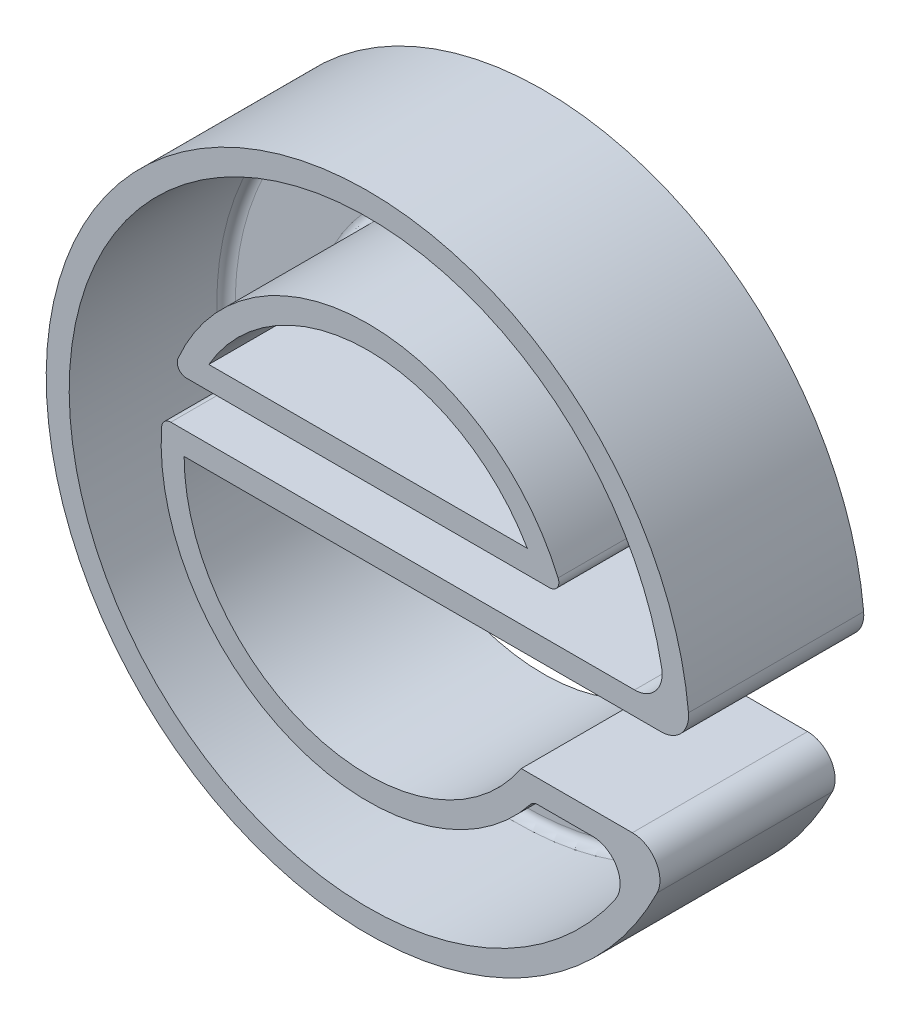
from build123d import *

# Parameters (mm, degrees)
BOSS_EXTRUDE6_DEPTH = 19.05
CUT_EXTRUDE2_DEPTH  = 17.05
FILLET2_R           = 3
FILLET1_R           = 1


with BuildPart() as part:
    # Sketch3 → Boss-Extrude6 (new body)
    with BuildSketch(Plane.XY):
        with BuildLine():
            Line((0, 0), (35, 0))
            ThreePointArc((35, 0), (-34.548087395, 5.606215958), (33.204019579, -11.067659364))
            Line((33.204019579, -11.067659364), (16.658538837, -11.067659364))
            ThreePointArc((16.658538837, -11.067659364), (-5.780537313, -19.146419727), (-20, 0))
            Line((-20, 0), (0, 0))
        make_face()
        with BuildLine():
            Line((-17.320508076, 10), (17.320508076, 10))
            ThreePointArc((17.320508076, 10), (0, 20), (-17.320508076, 10))
        make_face(mode=Mode.SUBTRACT)
    extrude(amount=BOSS_EXTRUDE6_DEPTH)

    # Sketch6 → Cut-Extrude2 (cut)
    with BuildSketch(Plane.XY.offset(19.05)):
        with BuildLine():
            Line((29.532501069, -13.567659364), (17.949056225, -13.567659364))
            ThreePointArc((17.949056225, -13.567659364), (-8.331147877, -20.900764939), (-22.360679775, 2.5))
            Line((-22.360679775, 2.5), (20, 2.5))
            Line((20, 2.5), (32.403703492, 2.5))
            ThreePointArc((32.403703492, 2.5), (-31.993214565, 5.717011614), (29.532501069, -13.567659364))
        make_face()
        with BuildLine():
            Line((21.213203436, 7.5), (-21.213203436, 7.5))
            ThreePointArc((-21.213203436, 7.5), (0, 22.5), (21.213203436, 7.5))
        make_face(mode=Mode.SUBTRACT)
    extrude(amount=-CUT_EXTRUDE2_DEPTH, mode=Mode.SUBTRACT)

    # Fillet2
    fillet2_edges = [part.edges().sort_by_distance(p)[0] for p in [
        (29.532501069, -13.567659364, 10.525),
        (32.403703492, 2.5, 10.525),
        (33.204019579, -11.067659364, 9.525),
        (35, 0, 9.525),
    ]]
    fillet(fillet2_edges, radius=FILLET2_R)

    # Fillet1
    fillet1_edges = [part.edges().sort_by_distance(p)[0] for p in [
        (3.311036859, 2.5, 2),
        (-8.331147877, -20.900764939, 2),
        (-22.360679775, 2.5, 10.525),
        (17.949056225, -13.567659364, 10.525),
        (0, 7.5, 2),
        (0, 22.5, 2),
        (21.213203436, 7.5, 10.525),
        (-21.213203436, 7.5, 10.525),
        (-31.823448952, 6.596824754, 2),
        (21.178653063, -13.567659364, 2),
        (27.059149761, -15.16312032, 2),
        (31.293377445, 3.586621588, 2),
    ]]
    fillet(fillet1_edges, radius=FILLET1_R)


solid = part.part
